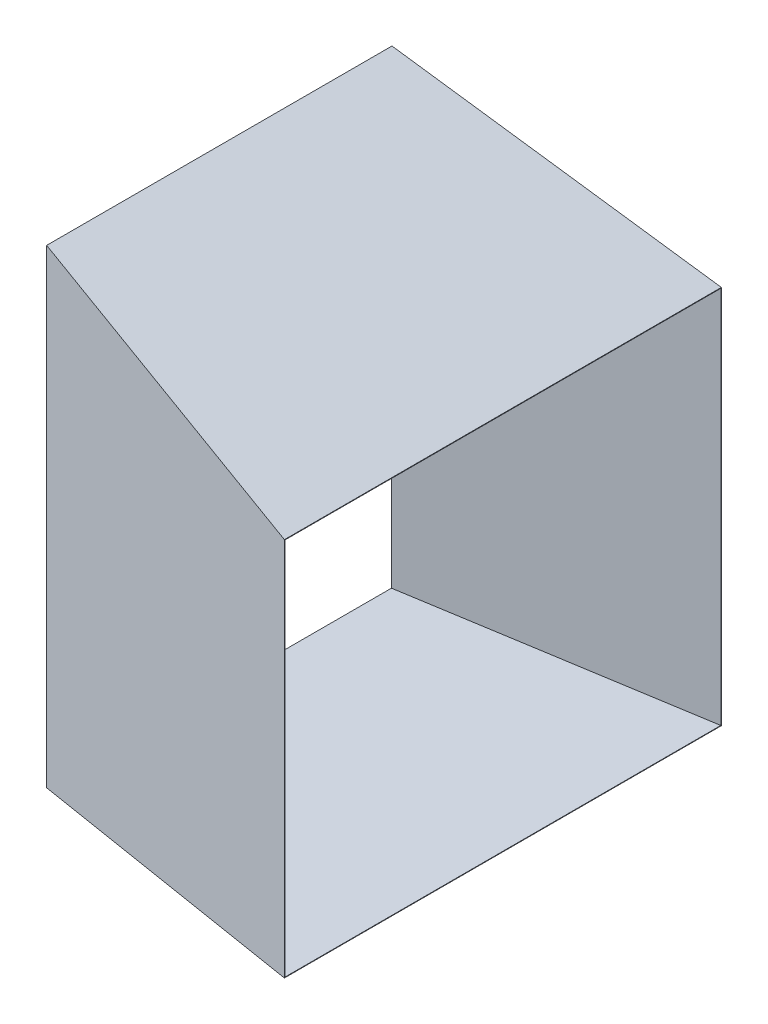
from build123d import *

# Parameters (mm, degrees)
BOSS_EXTRUDE1_DEPTH      = 1039.25
BOSS_EXTRUDE1_DEPTH_BACK = 1039.25
CUT_EXTRUDE1_DEPTH       = 4942.25
SHELL2_T                 = -2.5


with BuildPart() as part:
    # Sketch1 → Boss-Extrude1 (new, two sides: drawn at the far end of the back side and taken through both)
    with BuildSketch(Plane.XY.offset(-BOSS_EXTRUDE1_DEPTH_BACK)):
        Polygon((0, 0), (1349, 0), (1349, 1806), (0, 2235), align=None)
    extrude(amount=BOSS_EXTRUDE1_DEPTH + BOSS_EXTRUDE1_DEPTH_BACK)

    # Sketch2 → Cut-Extrude1 (cut)
    with BuildSketch(Plane.XZ):
        Polygon((0, 821.33), (0, 1039.25), (1349, 1039.25), align=None)
        Polygon((0, -1039.25), (1349, -1039.25), (0, -821.33), align=None)
    extrude(amount=-CUT_EXTRUDE1_DEPTH, mode=Mode.SUBTRACT)

    # Shell2
    shell2_openings = [part.faces().sort_by_distance(p)[0] for p in [
        (1349, 903, 0),
        (0, 1117.5, 0),
    ]]
    offset(amount=SHELL2_T, openings=shell2_openings, kind=Kind.INTERSECTION)


solid = part.part
